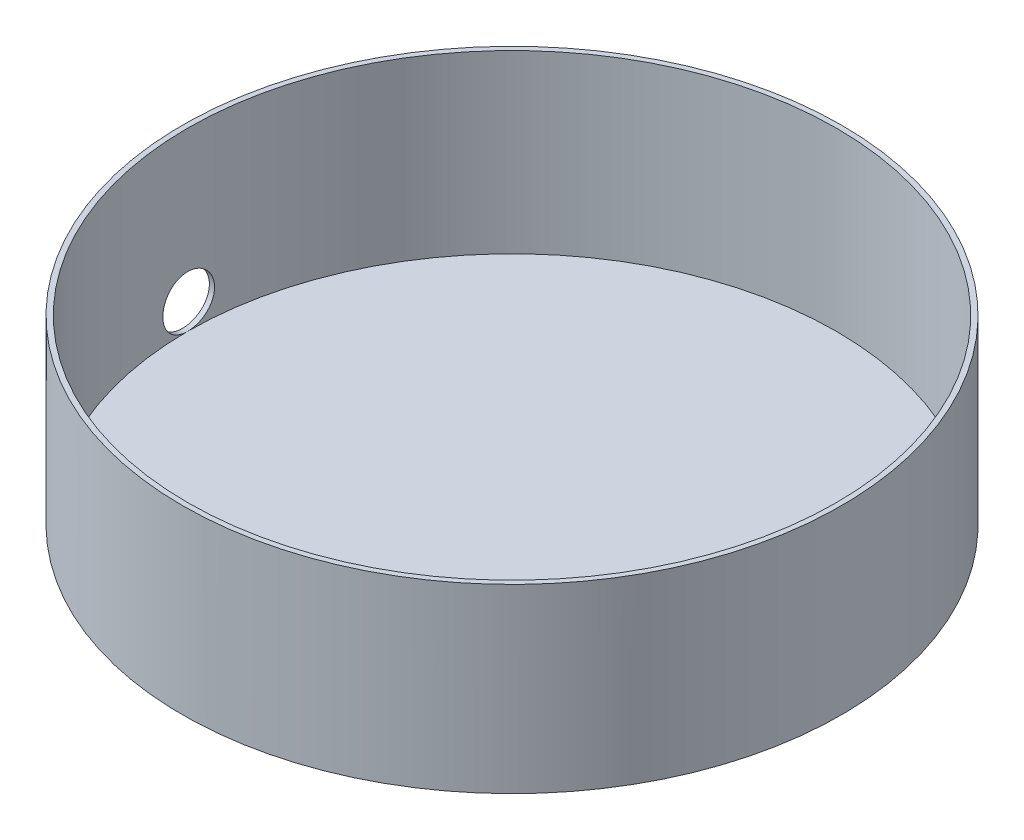
from build123d import *

# Parameters (mm, degrees)
SKETCH1_R           = 127.3
SKETCH1_R_2         = 125.3
BOSS_EXTRUDE1_DEPTH = 68
BOSS_EXTRUDE2_START = 2
SKETCH4_R           = 127.3
BOSS_EXTRUDE2_DEPTH = 2
SKETCH3_R           = 10
CUT_EXTRUDE3_DEPTH  = 193.443706055


with BuildPart() as part:
    # Sketch1 → Boss-Extrude1 (new body)
    with BuildSketch(Plane(origin=(0, 0, 0), x_dir=(1, 0, 0), z_dir=(0, 1, 0))):
        with Locations(Location((0, 0, 0), (0, 0, 270))):
            Circle(SKETCH1_R)
        with Locations(Location((0, 0, 0), (0, 0, 270))):
            Circle(SKETCH1_R_2, mode=Mode.SUBTRACT)
    extrude(amount=BOSS_EXTRUDE1_DEPTH)

    # Sketch4 → Boss-Extrude2 (add)
    with BuildSketch(Plane.XZ.offset(BOSS_EXTRUDE2_START)):
        with Locations(Location((0, 0, 0), (0, 0, 270))):
            Circle(SKETCH4_R)
    extrude(amount=-BOSS_EXTRUDE2_DEPTH)

    # Sketch3 → Cut-Extrude3 (cut, through all)
    with BuildSketch(Plane(origin=(0, 0, 0), x_dir=(0, 0, -1), z_dir=(1, 0, 0))):
        with Locations(Location((0, 10, 0), (0, 0, 270))):
            Circle(SKETCH3_R)
    extrude(amount=-CUT_EXTRUDE3_DEPTH, mode=Mode.SUBTRACT)


solid = part.part
